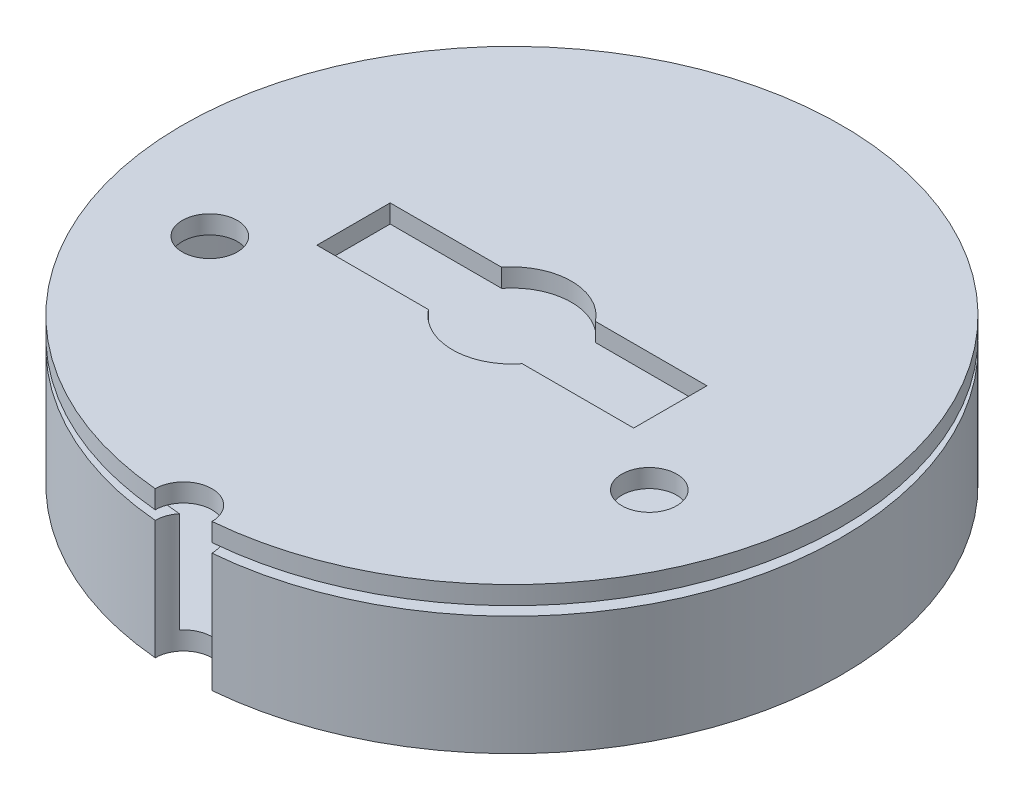
from build123d import *

# Parameters (mm, degrees)
SKETCH1_R               = 5.588
BOSS_EXTRUDE1_DEPTH     = 20.32
CUT_EXTRUDE5_START      = 2.54
SKETCH5_R               = 8.255
CUT_EXTRUDE5_DEPTH      = 47.498
CUT_EXTRUDE7_START      = 17.78
SKETCH6_R               = 43.18
CUT_EXTRUDE7_DEPTH      = 15.24
CUT_EXTRUDE8_START      = 10.16
SKETCH7_W               = 43.942
SKETCH7_H               = 10.16
CUT_EXTRUDE8_DEPTH      = 28.448
CUT_EXTRUDE9_DEPTH      = 72.898
CUT_EXTRUDE9_DEPTH_BACK = 70.612
SKETCH8_W               = 108.573094023
SKETCH8_H               = 1.27
SKETCH9_R               = 3.81
CUT_EXTRUDE10_DEPTH     = 39.37


with BuildPart() as part:
    # Sketch1 → Boss-Extrude1 (new body)
    with BuildSketch(Plane(origin=(0, 0, 0), x_dir=(1, 0, 0), z_dir=(0, 1, 0))):
        with BuildLine():
            ThreePointArc((3.937, -45.550174873), (0, 45.72), (-3.937, -45.550174873))
            ThreePointArc((-3.937, -45.550174873), (0, -41.613174873), (3.937, -45.550174873))
        make_face()
        with Locations(Location((0, 0, 0), (0, 0, 270))):
            Circle(SKETCH1_R, mode=Mode.SUBTRACT)
    extrude(amount=BOSS_EXTRUDE1_DEPTH)

    # Sketch5 → Cut-Extrude5 (cut)
    with BuildSketch(Plane(origin=(0, 0, 0), x_dir=(1, 0, 0), z_dir=(0, 1, 0)).offset(CUT_EXTRUDE5_START)):
        with Locations(Location((0, 0, 0), (0, 0, 90))):
            Circle(SKETCH5_R)
    extrude(amount=CUT_EXTRUDE5_DEPTH, mode=Mode.SUBTRACT)

    # Sketch6 → Cut-Extrude7 (cut)
    with BuildSketch(Plane(origin=(0, 0, 0), x_dir=(1, 0, 0), z_dir=(0, 1, 0)).offset(CUT_EXTRUDE7_START)):
        Circle(SKETCH6_R)
    extrude(amount=-CUT_EXTRUDE7_DEPTH, mode=Mode.SUBTRACT)

    # Sketch7 → Cut-Extrude8 (cut)
    with BuildSketch(Plane(origin=(0, 0, 0), x_dir=(1, 0, 0), z_dir=(0, 1, 0)).offset(CUT_EXTRUDE8_START)):
        Rectangle(SKETCH7_W, SKETCH7_H)
    extrude(amount=CUT_EXTRUDE8_DEPTH, mode=Mode.SUBTRACT)

    # Sketch8 → Cut-Extrude9 (cut, two sides: drawn at the far end of the back side and taken through both)
    with BuildSketch(Plane(origin=(0, 0, 0), x_dir=(0, 0, -1), z_dir=(1, 0, 0)).offset(-CUT_EXTRUDE9_DEPTH_BACK)):
        with Locations((1.451126255, 17.145)):
            Rectangle(SKETCH8_W, SKETCH8_H)
    extrude(amount=CUT_EXTRUDE9_DEPTH + CUT_EXTRUDE9_DEPTH_BACK, mode=Mode.SUBTRACT)


with BuildPart() as cut_extrude9_piece_1:
    # of the separate pieces the step leaves, piece 1, a body of its own (cut_extrude9_pieces)
    add(part.part.solids().sort_by_distance((-3.937, 0, 45.550174873))[0])


with BuildPart() as cut_extrude9_piece_2:
    # of the separate pieces the step leaves, piece 2, a body of its own (cut_extrude9_pieces)
    add(part.part.solids().sort_by_distance((-3.937, 17.78, 45.550174873))[0])


with BuildPart() as cut_extrude10_tool:
    # Sketch9 → Cut-Extrude10 (new body)
    with BuildSketch(Plane(origin=(0, 0, 0), x_dir=(1, 0, 0), z_dir=(0, 1, 0))):
        with Locations(Location((-30.48, -11.43, 0), (0, 0, 270))):
            Circle(SKETCH9_R)
        with Locations(Location((30.48, -11.43, 0), (0, 0, 270))):
            Circle(SKETCH9_R)
    extrude(amount=CUT_EXTRUDE10_DEPTH)


with BuildPart() as cut_extrude9_piece_1_1:
    add(cut_extrude9_piece_1.part)

    # Cut-Extrude10: cut by cut_extrude10_tool
    add(cut_extrude10_tool.part, mode=Mode.SUBTRACT)


with BuildPart() as cut_extrude9_piece_2_1:
    add(cut_extrude9_piece_2.part)

    # Cut-Extrude10: cut by cut_extrude10_tool
    add(cut_extrude10_tool.part, mode=Mode.SUBTRACT)


solid = Compound([cut_extrude9_piece_1_1.part, cut_extrude9_piece_2_1.part])
